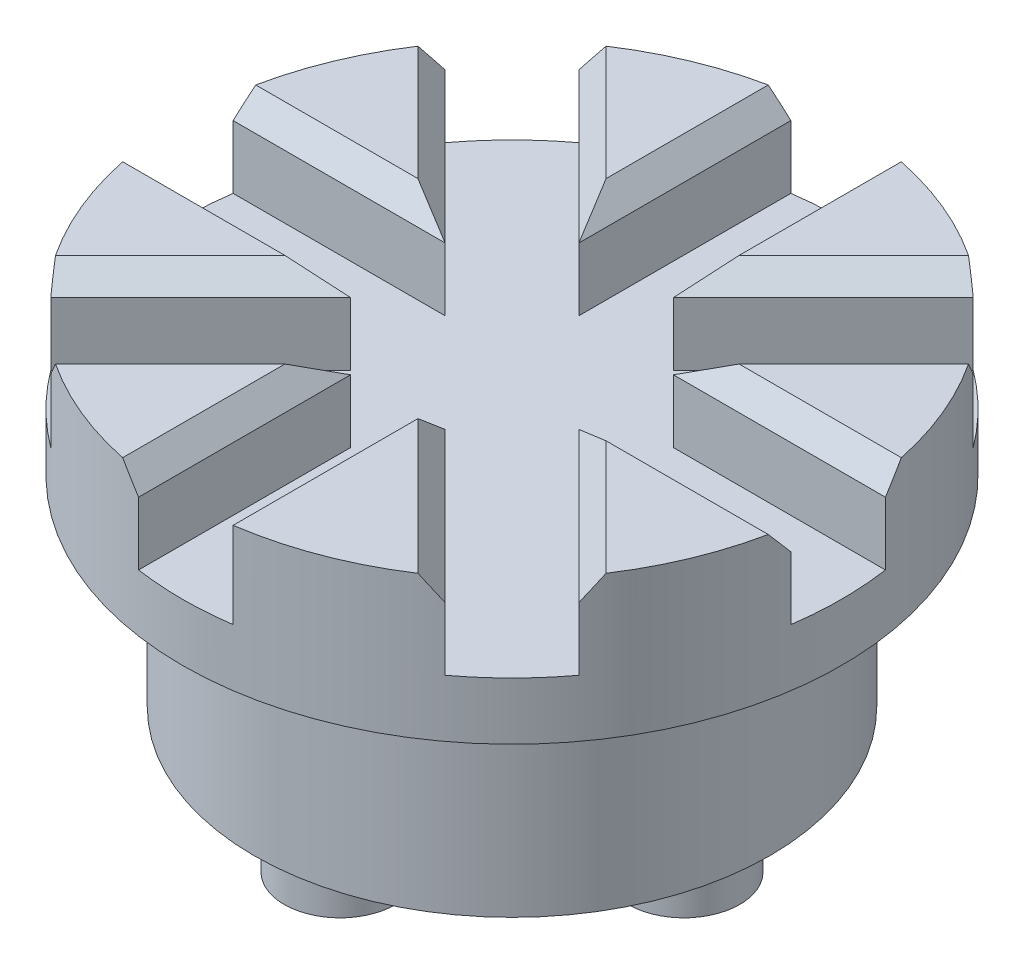
from build123d import *
from OCP.BRepFilletAPI import BRepFilletAPI_MakeChamfer

# Parameters (mm, degrees)
SKETCH1_R           = 9
BOSS_EXTRUDE1_DEPTH = 12
SKETCH1_3_R         = 1.95
BOSS_EXTRUDE2_DEPTH = 2
BOSS_EXTRUDE3_START = -5
SKETCH4_R           = 11.5
SKETCH4_R_2         = 9
BOSS_EXTRUDE3_DEPTH = 5
CUT_EXTRUDE2_DEPTH  = 3
CHAMFER1_SIZE       = 0.8
CHAMFER1_SIZE2      = 0.671279705


with BuildPart() as part:
    # Sketch1 → Boss-Extrude1 (new body)
    with BuildSketch(Plane(origin=(0, 0, 0), x_dir=(1, 0, 0), z_dir=(0, 1, 0))):
        Circle(SKETCH1_R)
    extrude(amount=BOSS_EXTRUDE1_DEPTH)

    # Sketch1<3> → Boss-Extrude2 (add)
    with BuildSketch(Plane(origin=(0, 0, 0), x_dir=(1, 0, 0), z_dir=(0, 1, 0))):
        with Locations((-6, 0)):
            Circle(SKETCH1_3_R)
        with Locations((0, 6)):
            Circle(SKETCH1_3_R)
        with Locations((6, 0)):
            Circle(SKETCH1_3_R)
        with Locations((0, -6)):
            Circle(SKETCH1_3_R)
    extrude(amount=-BOSS_EXTRUDE2_DEPTH)

    # Sketch4 → Boss-Extrude3 (add)
    with BuildSketch(Plane(origin=(0, 12, 0), x_dir=(1, 0, 0), z_dir=(0, 1, 0)).offset(BOSS_EXTRUDE3_START)):
        Circle(SKETCH4_R)
        Circle(SKETCH4_R_2, mode=Mode.SUBTRACT)
    extrude(amount=BOSS_EXTRUDE3_DEPTH)

    # Sketch3 → Cut-Extrude2 (cut)
    with BuildSketch(Plane(origin=(0, 12, 0), x_dir=(1, 0, 0), z_dir=(0, 1, 0))):
        with BuildLine():
            Line((1.65, 3.983452378), (1.65, 12.188826851))
            ThreePointArc((1.65, 12.188826851), (0, 12.3), (-1.65, 12.188826851))
            Line((-1.65, 12.188826851), (-1.65, 3.983452378))
            Line((-1.65, 3.983452378), (-7.452075932, 9.78552831))
            ThreePointArc((-7.452075932, 9.78552831), (-8.697413409, 8.697413409), (-9.78552831, 7.452075932))
            Line((-9.78552831, 7.452075932), (-3.983452378, 1.65))
            Line((-3.983452378, 1.65), (-12.188826851, 1.65))
            ThreePointArc((-12.188826851, 1.65), (-12.3, 0), (-12.188826851, -1.65))
            Line((-12.188826851, -1.65), (-3.983452378, -1.65))
            Line((-3.983452378, -1.65), (-9.78552831, -7.452075932))
            ThreePointArc((-9.78552831, -7.452075932), (-8.697413409, -8.697413409), (-7.452075932, -9.78552831))
            Line((-7.452075932, -9.78552831), (-1.65, -3.983452378))
            Line((-1.65, -3.983452378), (-1.65, -12.188826851))
            ThreePointArc((-1.65, -12.188826851), (0, -12.3), (1.65, -12.188826851))
            Line((1.65, -12.188826851), (1.65, -3.983452378))
            Line((1.65, -3.983452378), (7.452075932, -9.78552831))
            ThreePointArc((7.452075932, -9.78552831), (8.697413409, -8.697413409), (9.78552831, -7.452075932))
            Line((9.78552831, -7.452075932), (3.983452378, -1.65))
            Line((3.983452378, -1.65), (12.188826851, -1.65))
            ThreePointArc((12.188826851, -1.65), (12.27217524, -0.826870526), (12.3, 0))
            ThreePointArc((12.3, 0), (12.27217524, 0.826870526), (12.188826851, 1.65))
            Line((12.188826851, 1.65), (3.983452378, 1.65))
            Line((3.983452378, 1.65), (9.78552831, 7.452075932))
            ThreePointArc((9.78552831, 7.452075932), (8.697413409, 8.697413409), (7.452075932, 9.78552831))
            Line((7.452075932, 9.78552831), (1.65, 3.983452378))
        make_face()
    extrude(amount=-CUT_EXTRUDE2_DEPTH, mode=Mode.SUBTRACT)

    # Chamfer1: one chamfer whose edges measure the first distance from different faces: ONE call of the kernel's chamfer builder (chamfer() names one face for all edges)
    chamfer1_edges_1 = [part.edges().sort_by_distance(p)[0] for p in [
        (-7.682233636, 12, 1.65),
    ]]
    chamfer1_side_1 = [part.faces().sort_by_distance(p)[0] for p in [
        (-7.682233636, 10.5, 1.65),
    ]]
    chamfer1_edges_2 = [part.edges().sort_by_distance(p)[0] for p in [
        (-6.598885687, 12, 4.265433309),
    ]]
    chamfer1_side_2 = [part.faces().sort_by_distance(p)[0] for p in [
        (-6.598885687, 10.5, 4.265433309),
    ]]
    chamfer1_edges_3 = [part.edges().sort_by_distance(p)[0] for p in [
        (-4.265433309, 12, 6.598885687),
    ]]
    chamfer1_side_3 = [part.faces().sort_by_distance(p)[0] for p in [
        (-4.265433309, 10.5, 6.598885687),
    ]]
    chamfer1_edges_4 = [part.edges().sort_by_distance(p)[0] for p in [
        (-1.65, 12, 7.682233636),
    ]]
    chamfer1_side_4 = [part.faces().sort_by_distance(p)[0] for p in [
        (-1.65, 10.5, 7.682233636),
    ]]
    chamfer1_edges_5 = [part.edges().sort_by_distance(p)[0] for p in [
        (4.265433309, 12, 6.598885687),
    ]]
    chamfer1_side_5 = [part.faces().sort_by_distance(p)[0] for p in [
        (4.265433309, 10.5, 6.598885687),
    ]]
    chamfer1_edges_6 = [part.edges().sort_by_distance(p)[0] for p in [
        (6.598885687, 12, 4.265433309),
    ]]
    chamfer1_side_6 = [part.faces().sort_by_distance(p)[0] for p in [
        (6.598885687, 10.5, 4.265433309),
    ]]
    chamfer1_edges_7 = [part.edges().sort_by_distance(p)[0] for p in [
        (7.682233636, 12, 1.65),
    ]]
    chamfer1_side_7 = [part.faces().sort_by_distance(p)[0] for p in [
        (7.682233636, 10.5, 1.65),
    ]]
    chamfer1_edges_8 = [part.edges().sort_by_distance(p)[0] for p in [
        (7.682233636, 12, -1.65),
    ]]
    chamfer1_side_8 = [part.faces().sort_by_distance(p)[0] for p in [
        (7.682233636, 10.5, -1.65),
    ]]
    chamfer1_edges_9 = [part.edges().sort_by_distance(p)[0] for p in [
        (6.598885687, 12, -4.265433309),
    ]]
    chamfer1_side_9 = [part.faces().sort_by_distance(p)[0] for p in [
        (6.598885687, 10.5, -4.265433309),
    ]]
    chamfer1_edges_10 = [part.edges().sort_by_distance(p)[0] for p in [
        (4.265433309, 12, -6.598885687),
    ]]
    chamfer1_side_10 = [part.faces().sort_by_distance(p)[0] for p in [
        (4.265433309, 10.5, -6.598885687),
    ]]
    chamfer1_edges_11 = [part.edges().sort_by_distance(p)[0] for p in [
        (1.65, 12, -7.682233636),
    ]]
    chamfer1_side_11 = [part.faces().sort_by_distance(p)[0] for p in [
        (1.65, 10.5, -7.682233636),
    ]]
    chamfer1_edges_12 = [part.edges().sort_by_distance(p)[0] for p in [
        (-1.65, 12, -7.682233636),
    ]]
    chamfer1_side_12 = [part.faces().sort_by_distance(p)[0] for p in [
        (-1.65, 10.5, -7.682233636),
    ]]
    chamfer1_edges_13 = [part.edges().sort_by_distance(p)[0] for p in [
        (-4.265433309, 12, -6.598885687),
    ]]
    chamfer1_side_13 = [part.faces().sort_by_distance(p)[0] for p in [
        (-4.265433309, 10.5, -6.598885687),
    ]]
    chamfer1_edges_14 = [part.edges().sort_by_distance(p)[0] for p in [
        (-7.682233636, 12, -1.65),
    ]]
    chamfer1_side_14 = [part.faces().sort_by_distance(p)[0] for p in [
        (-7.682233636, 10.5, -1.65),
    ]]
    chamfer1_edges_15 = [part.edges().sort_by_distance(p)[0] for p in [
        (-6.598885687, 12, -4.265433309),
    ]]
    chamfer1_side_15 = [part.faces().sort_by_distance(p)[0] for p in [
        (-6.598885687, 10.5, -4.265433309),
    ]]
    chamfer1 = BRepFilletAPI_MakeChamfer(part.part.solid().wrapped)
    for e in chamfer1_edges_1:
        chamfer1.Add(CHAMFER1_SIZE, CHAMFER1_SIZE2, e.wrapped, chamfer1_side_1[0].wrapped)  # the first distance lies on this face
    for e in chamfer1_edges_2:
        chamfer1.Add(CHAMFER1_SIZE, CHAMFER1_SIZE2, e.wrapped, chamfer1_side_2[0].wrapped)  # the first distance lies on this face
    for e in chamfer1_edges_3:
        chamfer1.Add(CHAMFER1_SIZE, CHAMFER1_SIZE2, e.wrapped, chamfer1_side_3[0].wrapped)  # the first distance lies on this face
    for e in chamfer1_edges_4:
        chamfer1.Add(CHAMFER1_SIZE, CHAMFER1_SIZE2, e.wrapped, chamfer1_side_4[0].wrapped)  # the first distance lies on this face
    for e in chamfer1_edges_5:
        chamfer1.Add(CHAMFER1_SIZE, CHAMFER1_SIZE2, e.wrapped, chamfer1_side_5[0].wrapped)  # the first distance lies on this face
    for e in chamfer1_edges_6:
        chamfer1.Add(CHAMFER1_SIZE, CHAMFER1_SIZE2, e.wrapped, chamfer1_side_6[0].wrapped)  # the first distance lies on this face
    for e in chamfer1_edges_7:
        chamfer1.Add(CHAMFER1_SIZE, CHAMFER1_SIZE2, e.wrapped, chamfer1_side_7[0].wrapped)  # the first distance lies on this face
    for e in chamfer1_edges_8:
        chamfer1.Add(CHAMFER1_SIZE, CHAMFER1_SIZE2, e.wrapped, chamfer1_side_8[0].wrapped)  # the first distance lies on this face
    for e in chamfer1_edges_9:
        chamfer1.Add(CHAMFER1_SIZE, CHAMFER1_SIZE2, e.wrapped, chamfer1_side_9[0].wrapped)  # the first distance lies on this face
    for e in chamfer1_edges_10:
        chamfer1.Add(CHAMFER1_SIZE, CHAMFER1_SIZE2, e.wrapped, chamfer1_side_10[0].wrapped)  # the first distance lies on this face
    for e in chamfer1_edges_11:
        chamfer1.Add(CHAMFER1_SIZE, CHAMFER1_SIZE2, e.wrapped, chamfer1_side_11[0].wrapped)  # the first distance lies on this face
    for e in chamfer1_edges_12:
        chamfer1.Add(CHAMFER1_SIZE, CHAMFER1_SIZE2, e.wrapped, chamfer1_side_12[0].wrapped)  # the first distance lies on this face
    for e in chamfer1_edges_13:
        chamfer1.Add(CHAMFER1_SIZE, CHAMFER1_SIZE2, e.wrapped, chamfer1_side_13[0].wrapped)  # the first distance lies on this face
    for e in chamfer1_edges_14:
        chamfer1.Add(CHAMFER1_SIZE, CHAMFER1_SIZE2, e.wrapped, chamfer1_side_14[0].wrapped)  # the first distance lies on this face
    for e in chamfer1_edges_15:
        chamfer1.Add(CHAMFER1_SIZE, CHAMFER1_SIZE2, e.wrapped, chamfer1_side_15[0].wrapped)  # the first distance lies on this face
    add(Compound.cast(chamfer1.Shape()), mode=Mode.REPLACE)


solid = part.part
